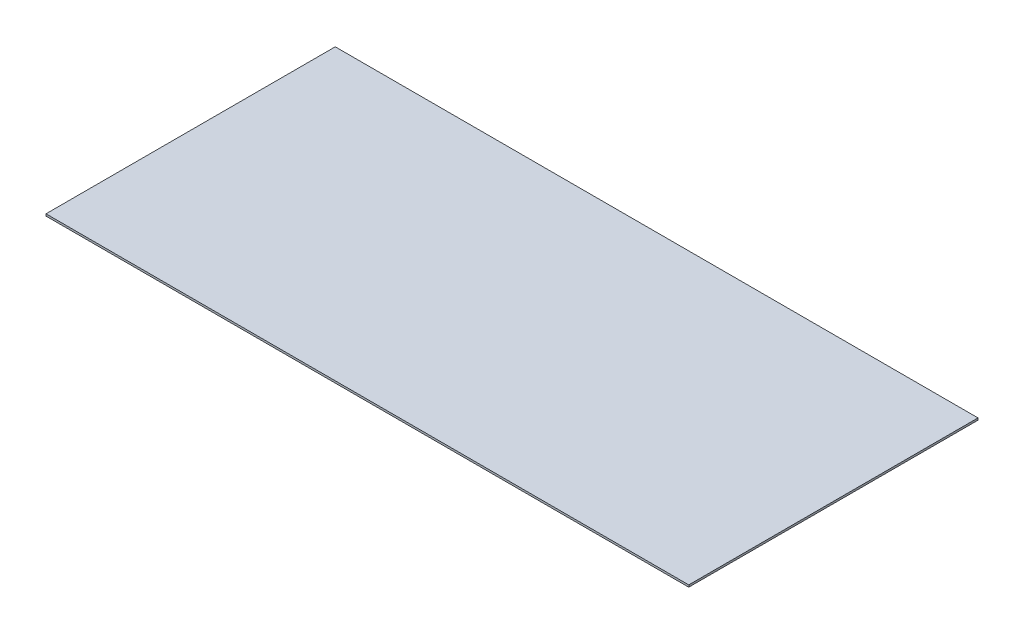
from build123d import *

# Parameters (mm, degrees)
SKETCH1_W           = 2032
SKETCH1_H           = 914.4
BOSS_EXTRUDE1_DEPTH = 6.35


with BuildPart() as part:
    # Sketch1 → Boss-Extrude1 (new body)
    with BuildSketch(Plane(origin=(0, 0, 0), x_dir=(1, 0, 0), z_dir=(0, 1, 0))):
        Rectangle(SKETCH1_W, SKETCH1_H)
    extrude(amount=BOSS_EXTRUDE1_DEPTH)


solid = part.part
